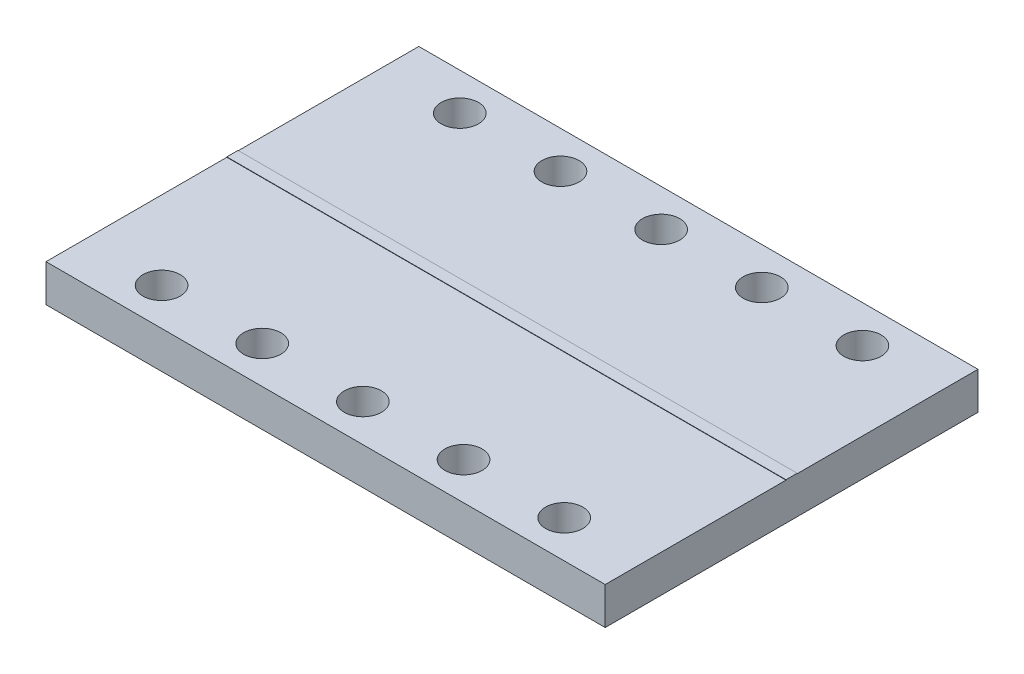
from build123d import *

# Parameters (mm, degrees)
SKETCH1_W           = 1500
SKETCH1_H           = 1000
SKETCH1_R           = 50
BOSS_EXTRUDE1_DEPTH = 100
BOSS_EXTRUDE2_DEPTH = 1


with BuildPart() as part:
    # Sketch1 → Boss-Extrude1 (new body)
    with BuildSketch(Plane(origin=(0, 0, 0), x_dir=(1, 0, 0), z_dir=(0, 1, 0))):
        Rectangle(SKETCH1_W, SKETCH1_H)
        with Locations(Location((-540, -400, 0), (0, 0, 270))):
            Circle(SKETCH1_R, mode=Mode.SUBTRACT)
        with Locations(Location((-270, -400, 0), (0, 0, 270))):
            Circle(SKETCH1_R, mode=Mode.SUBTRACT)
        with Locations(Location((0, -400, 0), (0, 0, 270))):
            Circle(SKETCH1_R, mode=Mode.SUBTRACT)
        with Locations(Location((270, -400, 0), (0, 0, 270))):
            Circle(SKETCH1_R, mode=Mode.SUBTRACT)
        with Locations(Location((540, -400, 0), (0, 0, 270))):
            Circle(SKETCH1_R, mode=Mode.SUBTRACT)
        with Locations(Location((-270, 400, 0), (0, 0, 270))):
            Circle(SKETCH1_R, mode=Mode.SUBTRACT)
        with Locations(Location((0, 400, 0), (0, 0, 270))):
            Circle(SKETCH1_R, mode=Mode.SUBTRACT)
        with Locations(Location((270, 400, 0), (0, 0, 270))):
            Circle(SKETCH1_R, mode=Mode.SUBTRACT)
        with Locations(Location((540, 400, 0), (0, 0, 270))):
            Circle(SKETCH1_R, mode=Mode.SUBTRACT)
        with Locations(Location((-540, 400, 0), (0, 0, 270))):
            Circle(SKETCH1_R, mode=Mode.SUBTRACT)
    extrude(amount=BOSS_EXTRUDE1_DEPTH)

    # Sketch2 → Boss-Extrude2 (add)
    with BuildSketch(Plane(origin=(0, 100, 0), x_dir=(1, 0, 0), z_dir=(0, 1, 0))):
        Polygon((-750, 0), (-750, 15), (750, 15), (750, -15), (-750, -15), align=None)
    extrude(amount=BOSS_EXTRUDE2_DEPTH)


solid = part.part
